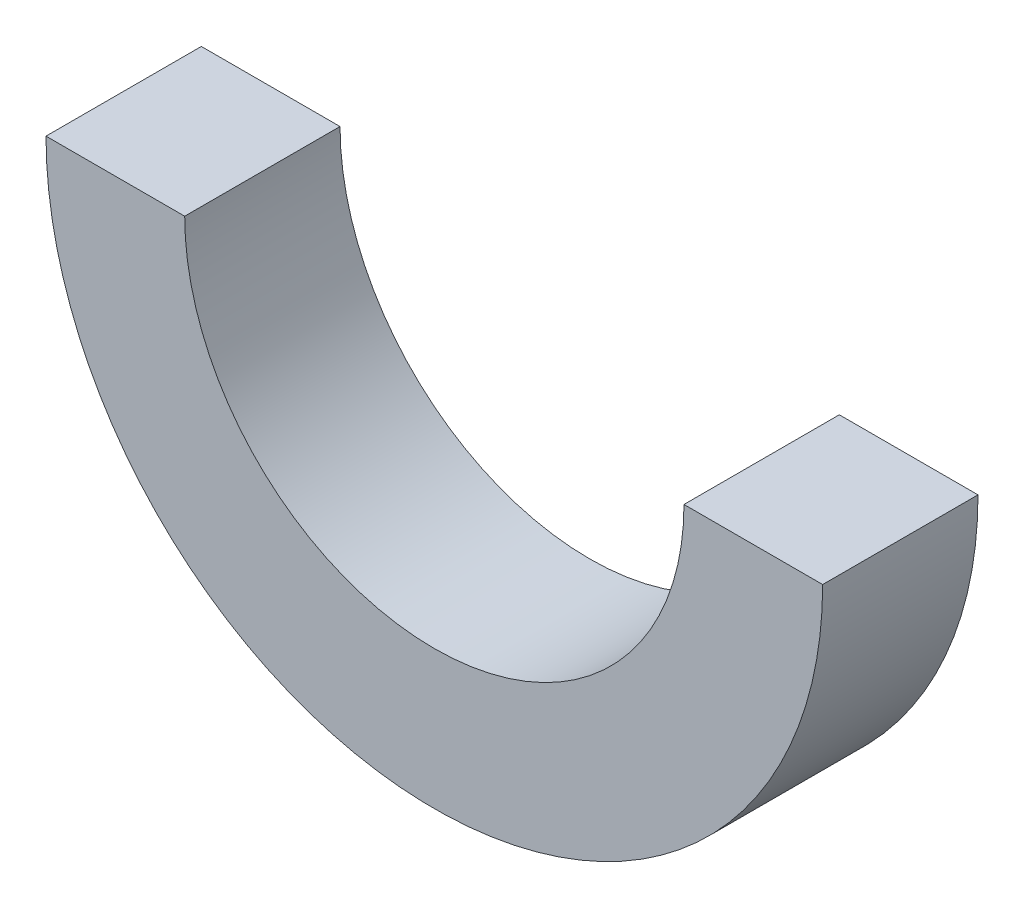
from build123d import *

# Parameters (mm, degrees)
EXTRUDE_1_DEPTH = 7


with BuildPart() as part:
    # 스케치1 → 보스-돌출1 (new body)
    with BuildSketch(Plane.XY):
        with BuildLine():
            Line((-11.25, 0), (-17.5, 0))
            ThreePointArc((-17.5, 0), (0, -17.5), (17.5, 0))
            Line((17.5, 0), (11.25, 0))
            ThreePointArc((11.25, 0), (0, -11.25), (-11.25, 0))
        make_face()
    extrude(amount=EXTRUDE_1_DEPTH)


solid = part.part
